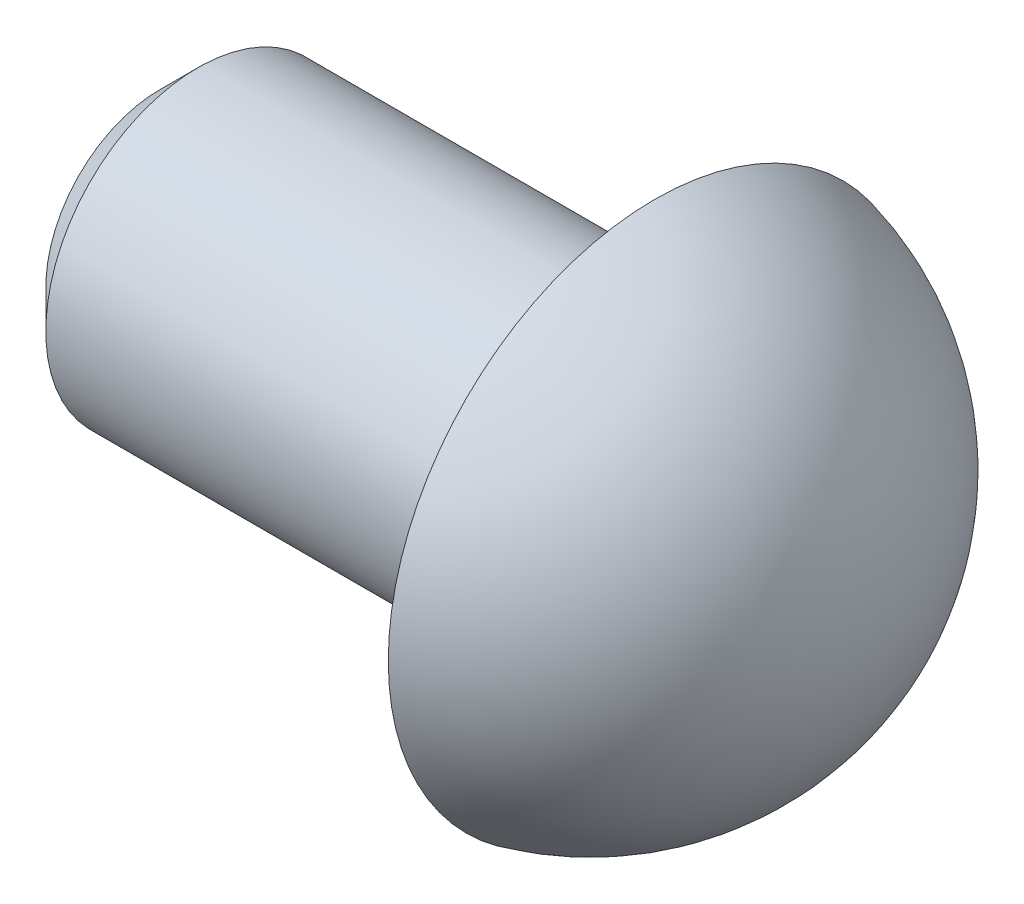
from build123d import *

# Parameters (mm, degrees)
SKETCH1_R           = 2
BOSS_EXTRUDE1_DEPTH = 6.5
CHAMFER1_SIZE       = 0.5


with BuildPart() as part:
    # Sketch1 → Boss-Extrude1 (new body)
    with BuildSketch(Plane(origin=(0, 0, 0), x_dir=(0, 0, -1), z_dir=(1, 0, 0))):
        Circle(SKETCH1_R)
    extrude(amount=-BOSS_EXTRUDE1_DEPTH)

    # Sketch2 → Revolve1 (revolve)
    with BuildSketch(Plane(origin=(0, 0, 0), x_dir=(1, 0, 0), z_dir=(0, 1, 0))):
        with BuildLine():
            Line((2.757385023, 0), (0, 0))
            Line((0, 0), (0, 3.5))
            ThreePointArc((0, 3.5), (1.985229955, 2.227844932), (2.757385023, 0))
        make_face()
    revolve(axis=Axis((-3.472141055, 0, 0), (1, 0, 0)))

    # Chamfer1
    chamfer1_edges = [part.edges().sort_by_distance(p)[0] for p in [
        (-6.5, 0, 2),
    ]]
    chamfer(chamfer1_edges, length=CHAMFER1_SIZE)


solid = part.part
